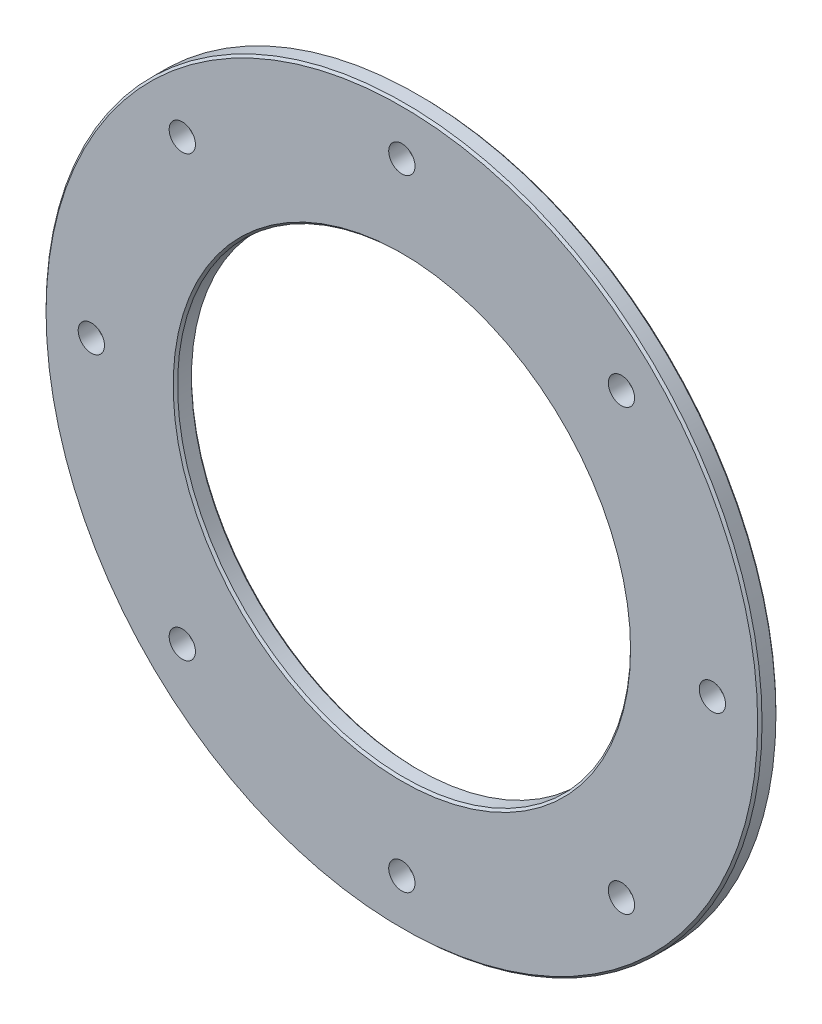
from build123d import *

# Parameters (mm, degrees)
SKETCH1_R                = 49
BOSS_EXTRUDE1_DEPTH      = 2.5
M3_CLEARANCE_HOLE1_D     = 3.6
M3_CLEARANCE_HOLE1_DEPTH = 20
M3_CLEARANCE_HOLE1_TIP   = 1.081549114
SKETCH4_R                = 31
CUT_EXTRUDE1_DEPTH       = 70.341545988
CHAMFER1_SIZE            = 0.3


with BuildPart() as part:
    # Sketch1 → Boss-Extrude1 (new body)
    with BuildSketch(Plane.XY):
        Circle(SKETCH1_R)
    extrude(amount=BOSS_EXTRUDE1_DEPTH)

    # M3 Clearance Hole1
    with Locations(Plane.XY.offset(2.5)):
        with Locations((-30.0520382, 30.0520382), (0, 42.5), (30.0520382, 30.0520382), (42.5, 0), (30.0520382, -30.0520382), (0, -42.5), (-30.0520382, -30.0520382), (-42.5, 0)):
            Hole(M3_CLEARANCE_HOLE1_D / 2, depth=M3_CLEARANCE_HOLE1_DEPTH)
            with Locations((0, 0, -(M3_CLEARANCE_HOLE1_DEPTH + M3_CLEARANCE_HOLE1_TIP / 2))):  # 118° drill point
                Cone(0, M3_CLEARANCE_HOLE1_D / 2, M3_CLEARANCE_HOLE1_TIP, mode=Mode.SUBTRACT)

    # Sketch4 → Cut-Extrude1 (cut, through all)
    with BuildSketch(Plane.XY.offset(2.5)):
        Circle(SKETCH4_R)
    extrude(amount=-CUT_EXTRUDE1_DEPTH, mode=Mode.SUBTRACT)

    # Chamfer1
    chamfer1_edges = [part.edges().sort_by_distance(p)[0] for p in [
        (-49, 0, 0),
        (-49, 0, 2.5),
        (-31, 0, 0),
        (-31, 0, 2.5),
    ]]
    chamfer(chamfer1_edges, length=CHAMFER1_SIZE)


solid = part.part
